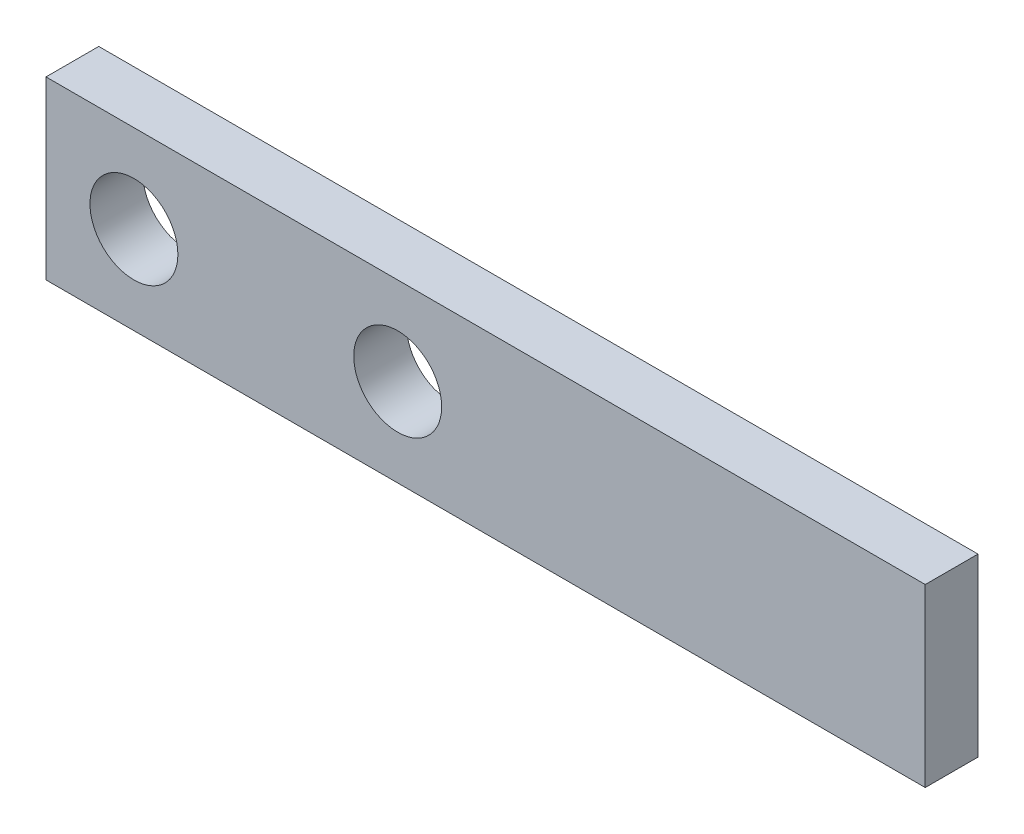
from build123d import *

# Parameters (mm, degrees)
SKETCH_1_W      = 50
SKETCH_1_H      = 10
SKETCH_1_R      = 2.5
EXTRUDE_1_DEPTH = 3


with BuildPart() as part:
    # 草圖1 → 填料-伸長1 (new body)
    with BuildSketch(Plane.XY):
        Rectangle(SKETCH_1_W, SKETCH_1_H)
        with Locations((-20, 0)):
            Circle(SKETCH_1_R, mode=Mode.SUBTRACT)
        with Locations((-5, 0)):
            Circle(SKETCH_1_R, mode=Mode.SUBTRACT)
    extrude(amount=EXTRUDE_1_DEPTH)


solid = part.part
